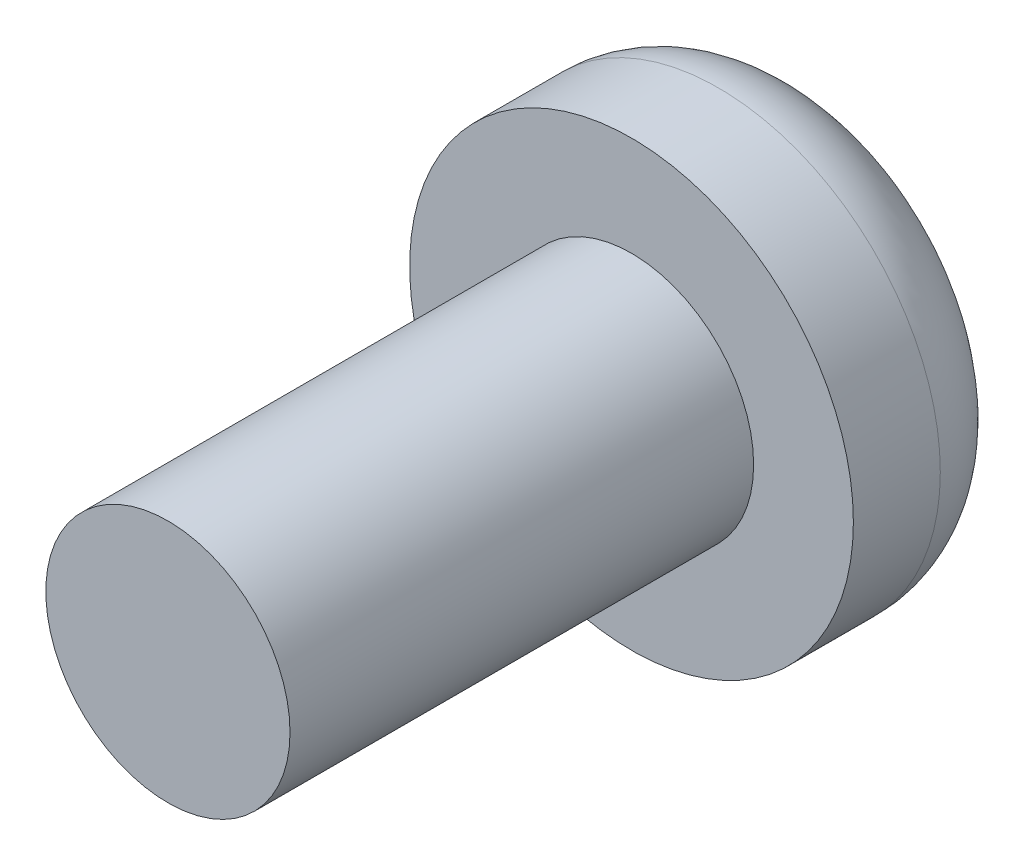
from build123d import *

# Parameters (mm, degrees)
CROQUIS1_R              = 1.475
SALIENTE_EXTRUIR1_DEPTH = 5.6
CROQUIS2_R              = 2.68
SALIENTE_EXTRUIR2_DEPTH = 2.15
CORTAR_EXTRUIR1_DEPTH   = 1.5
REDONDEO1_R             = 1.1


with BuildPart() as part:
    # Croquis1 → Saliente-Extruir1 (new body)
    with BuildSketch(Plane.XY):
        Circle(CROQUIS1_R)
    extrude(amount=SALIENTE_EXTRUIR1_DEPTH)

    # Croquis2 → Saliente-Extruir2 (add)
    with BuildSketch(Plane(origin=(0, 0, 0), x_dir=(-1, 0, 0), z_dir=(0, 0, -1))):
        with Locations(Location((0, 0, 0), (0, 0, 180))):
            Circle(CROQUIS2_R)
    extrude(amount=SALIENTE_EXTRUIR2_DEPTH)

    # Croquis3 → Cortar-Extruir1 (cut)
    with BuildSketch(Plane(origin=(0, 0, -2.15), x_dir=(-1, 0, 0), z_dir=(0, 0, -1))):
        Polygon((0, -1.419699202), (1.229495574, -0.709849601), (1.229495574, 0.709849601), (0, 1.419699202), (-1.229495574, 0.709849601), (-1.229495574, -0.709849601), align=None)
    extrude(amount=-CORTAR_EXTRUIR1_DEPTH, mode=Mode.SUBTRACT)

    # Redondeo1
    redondeo1_edges = [part.edges().sort_by_distance(p)[0] for p in [
        (-2.68, 0, -2.15),
    ]]
    fillet(redondeo1_edges, radius=REDONDEO1_R)


solid = part.part
